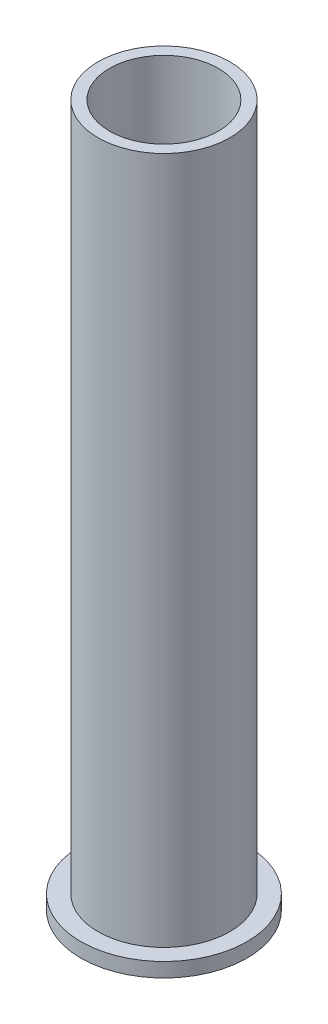
from build123d import *

# Parameters (mm, degrees)
SKETCH1_R           = 18.415
SKETCH1_R_2         = 12.065
BOSS_EXTRUDE1_DEPTH = 3.175
SKETCH2_R           = 14.605
SKETCH2_R_2         = 12.065
BOSS_EXTRUDE2_DEPTH = 152.4


with BuildPart() as part:
    # Sketch1 → Boss-Extrude1 (new body)
    with BuildSketch(Plane(origin=(0, 0, 0), x_dir=(1, 0, 0), z_dir=(0, 1, 0))):
        with Locations(Location((0, 0, 0), (0, 0, 270))):
            Circle(SKETCH1_R)
        with Locations(Location((0, 0, 0), (0, 0, 270))):
            Circle(SKETCH1_R_2, mode=Mode.SUBTRACT)
    extrude(amount=BOSS_EXTRUDE1_DEPTH)

    # Sketch2 → Boss-Extrude2 (add)
    with BuildSketch(Plane(origin=(0, 3.175, 0), x_dir=(1, 0, 0), z_dir=(0, 1, 0))):
        with Locations(Location((0, 0, 0), (0, 0, 90))):
            Circle(SKETCH2_R)
        with Locations(Location((0, 0, 0), (0, 0, 270))):
            Circle(SKETCH2_R_2, mode=Mode.SUBTRACT)
    extrude(amount=BOSS_EXTRUDE2_DEPTH)


solid = part.part
